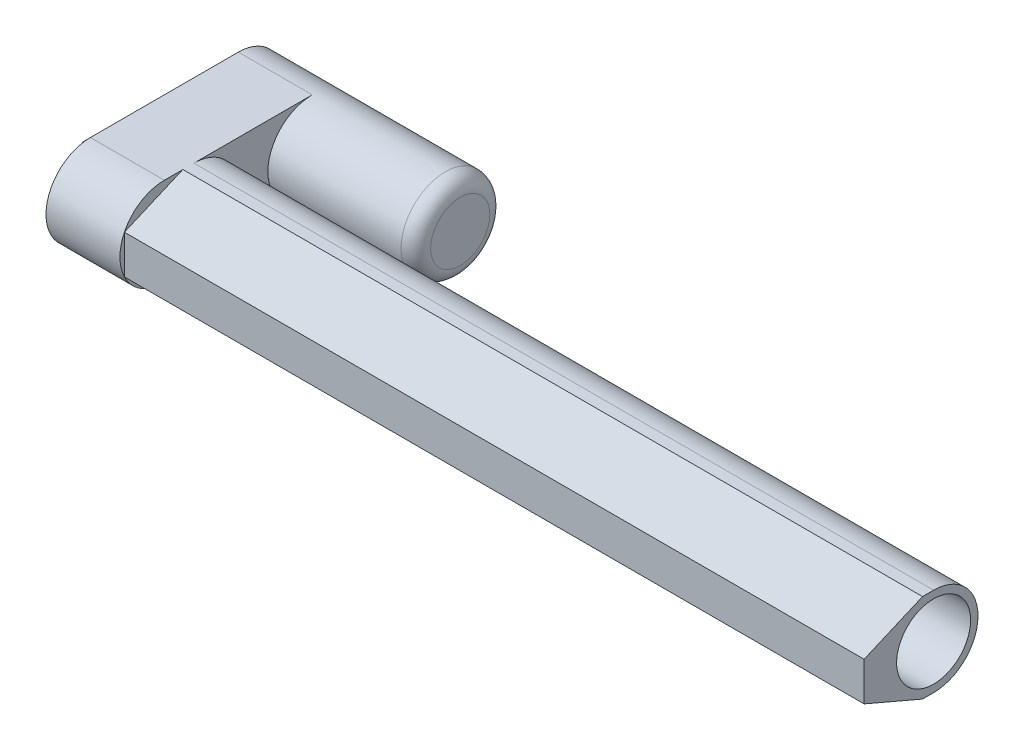
from build123d import *

# Parameters (mm, degrees)
BOSS_EXTRUDE3_DEPTH = 50
SKETCH7_R           = 30
BOSS_EXTRUDE4_DEPTH = 100
BOSS_EXTRUDE7_DEPTH = 500
SKETCH9_R           = 25
CUT_EXTRUDE1_DEPTH  = 500
CUT_EXTRUDE2_START  = -500
CUT_EXTRUDE2_DEPTH  = 500
FILLET1_R           = 10
SKETCH12_W          = 100
SKETCH12_H          = 20
BOSS_EXTRUDE8_DEPTH = 40
CUT_EXTRUDE3_DEPTH  = 40
SKETCH14_R          = 10
CUT_EXTRUDE4_DEPTH  = 40


with BuildPart() as part:
    # Sketch3 → Boss-Extrude3 (new body)
    with BuildSketch(Plane(origin=(0, 0, 0), x_dir=(0, 0, -1), z_dir=(1, 0, 0))):
        with BuildLine():
            Line((0, 30), (100, 30))
            ThreePointArc((100, 30), (130, 0), (100, -30))
            Line((100, -30), (0, -30))
            ThreePointArc((0, -30), (-30, 0), (0, 30))
        make_face()
    extrude(amount=BOSS_EXTRUDE3_DEPTH)

    # Sketch7 → Boss-Extrude4 (add)
    with BuildSketch(Plane(origin=(50, 0, 0), x_dir=(0, 0, -1), z_dir=(1, 0, 0))):
        with Locations(Location((100, 0, 0), (0, 0, 90))):
            Circle(SKETCH7_R)
    extrude(amount=BOSS_EXTRUDE4_DEPTH)

    # Sketch8 → Boss-Extrude7 (add)
    with BuildSketch(Plane(origin=(50, 0, 0), x_dir=(0, 0, -1), z_dir=(1, 0, 0))):
        with BuildLine():
            Line((0, 30), (20, 30))
            ThreePointArc((20, 30), (50, 0), (20, -30))
            Line((20, -30), (0, -30))
            ThreePointArc((0, -30), (-30, 0), (0, 30))
        make_face()
    extrude(amount=BOSS_EXTRUDE7_DEPTH)

    # Sketch9 → Cut-Extrude1 (cut)
    with BuildSketch(Plane(origin=(550, 0, 0), x_dir=(0, 0, -1), z_dir=(1, 0, 0))):
        with Locations((20, 0)):
            Circle(SKETCH9_R)
    extrude(amount=-CUT_EXTRUDE1_DEPTH, mode=Mode.SUBTRACT)

    # Sketch10 → Cut-Extrude2 (cut)
    with BuildSketch(Plane(origin=(550, 0, 0), x_dir=(0, 0, -1), z_dir=(1, 0, 0)).offset(CUT_EXTRUDE2_START)):
        with BuildLine():
            ThreePointArc((0, 30), (-15.932656638, 25.419489618), (-27, 13.076696831))
            Line((-27, 13.076696831), (12.529758535, 30))
            Line((12.529758535, 30), (0, 30))
        make_face()
        with BuildLine():
            Line((12.529758535, -30), (-27, -13.076696831))
            ThreePointArc((-27, -13.076696831), (-15.932656638, -25.419489618), (0, -30))
            Line((0, -30), (12.529758535, -30))
        make_face()
        with BuildLine():
            Line((-27, 0), (-27, 13.076696831))
            ThreePointArc((-27, 13.076696831), (-29.240383034, 6.708203932), (-30, 0))
            Line((-30, 0), (-27, 0))
        make_face()
        with BuildLine():
            Line((-27, -13.076696831), (-27, 0))
            Line((-27, 0), (-30, 0))
            ThreePointArc((-30, 0), (-29.240383034, -6.708203932), (-27, -13.076696831))
        make_face()
        with BuildLine():
            Line((-27, 0), (-27, 13.076696831))
            ThreePointArc((-27, 13.076696831), (-29.240383034, 6.708203932), (-30, 0))
            Line((-30, 0), (-27, 0))
        make_face()
        with BuildLine():
            Line((-27, -13.076696831), (-27, 0))
            Line((-27, 0), (-30, 0))
            ThreePointArc((-30, 0), (-29.240383034, -6.708203932), (-27, -13.076696831))
        make_face()
    extrude(amount=CUT_EXTRUDE2_DEPTH, mode=Mode.SUBTRACT)

    # Fillet1
    fillet1_edges = [part.edges().sort_by_distance(p)[0] for p in [
        (150, -30, -100),
    ]]
    fillet(fillet1_edges, radius=FILLET1_R)

    # Sketch12 → Boss-Extrude8 (add)
    with BuildSketch(Plane.ZY):
        with Locations((-50, -20)):
            Rectangle(SKETCH12_W, SKETCH12_H)
    extrude(amount=BOSS_EXTRUDE8_DEPTH)

    # Sketch13 → Cut-Extrude3 (cut)
    with BuildSketch(Plane.XZ.offset(30)):
        Polygon((-40, -35), (-25, 0), (-40, 0), align=None)
        Polygon((-40, -65), (-25, -100), (-40, -100), align=None)
    extrude(amount=-CUT_EXTRUDE3_DEPTH, mode=Mode.SUBTRACT)

    # Sketch14 → Cut-Extrude4 (cut)
    with BuildSketch(Plane(origin=(0, -30, 0), x_dir=(-1, 0, 0), z_dir=(0, -1, 0))):
        with Locations(Location((20, 25, 0), (0, 0, 90))):
            Circle(SKETCH14_R)
        with Locations(Location((20, 75, 0), (0, 0, 90))):
            Circle(SKETCH14_R)
    extrude(amount=-CUT_EXTRUDE4_DEPTH, mode=Mode.SUBTRACT)


solid = part.part
